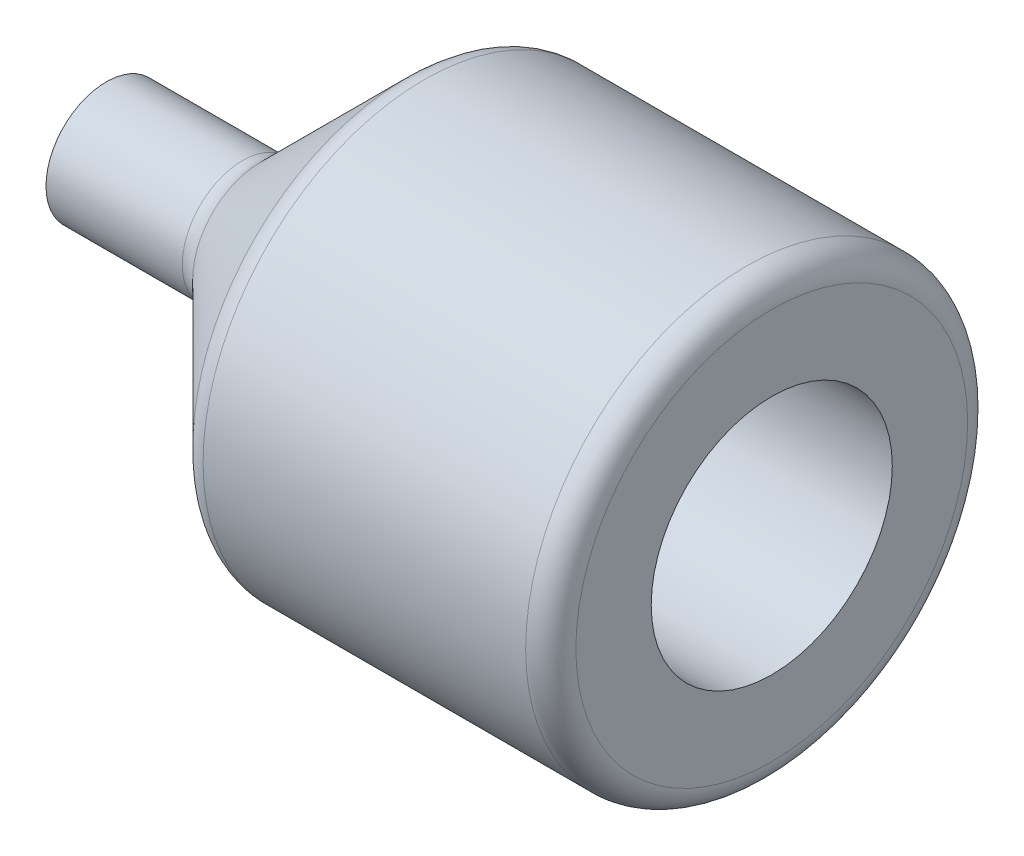
from build123d import *

# Parameters (mm, degrees)
FILLET1_R = 1


with BuildPart() as part:
    # Sketch1 → Revolve3 (revolve)
    with BuildSketch(Plane.XY.offset(84.279), mode=Mode.PRIVATE) as revolve3_sk:
        Polygon((-115.072, 105.221), (-109.230578644, 105.221), (-102.830578644, 111.621), (-88.572, 111.621), (-88.572, 107.621), (-96.272, 107.621), (-101.072, 102.821), (-115.072, 102.821), align=None)
    revolve(revolve3_sk.sketch.rotate(Axis((-96.072, 102.821, 84.279), (1, 0, 0)), 90), axis=Axis((-96.072, 102.821, 84.279), (1, 0, 0)))

    # Fillet1
    fillet1_edges = [part.edges().sort_by_distance(p)[0] for p in [
        (-109.230578644, 102.821, 81.879),
        (-102.830578644, 102.821, 75.479),
        (-88.572, 102.821, 75.479),
    ]]
    fillet(fillet1_edges, radius=FILLET1_R)


solid = part.part
